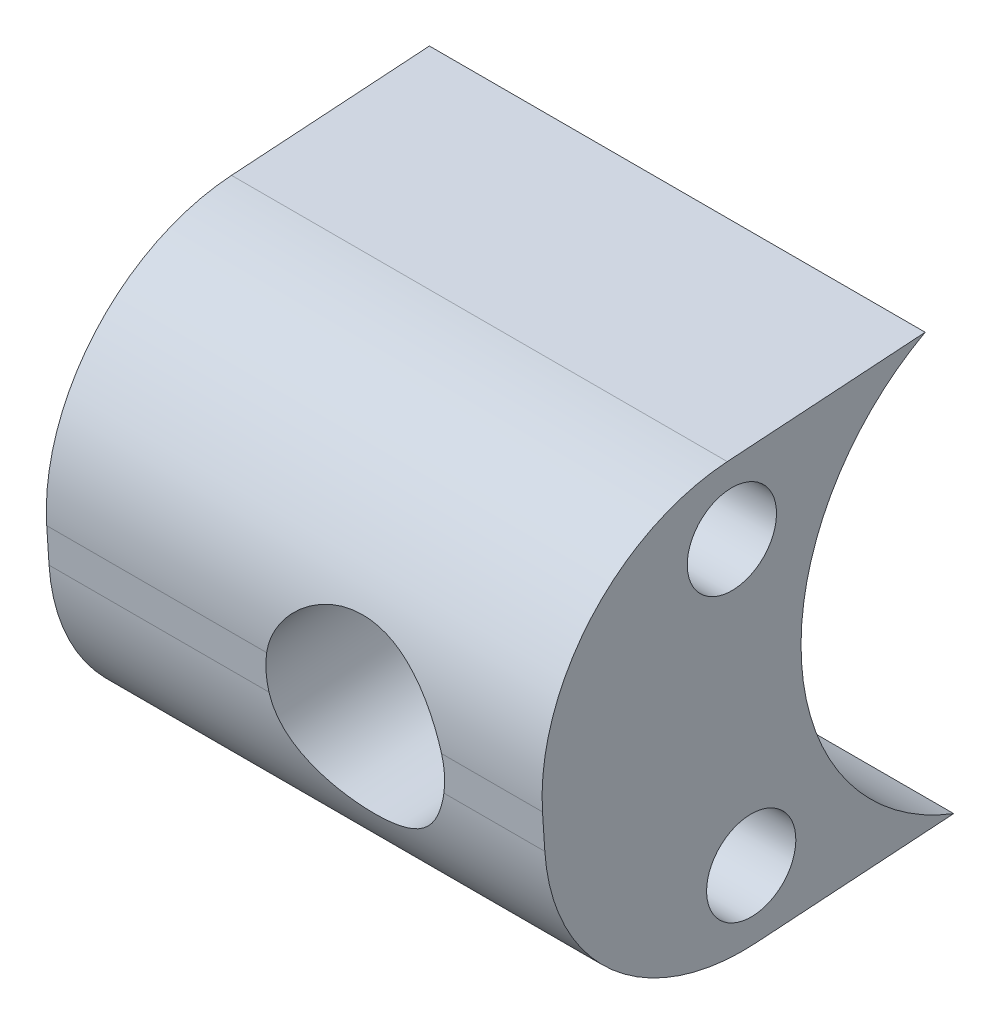
from build123d import *

# Parameters (mm, degrees)
BOSS_EXTRUDE1_DEPTH     = 25
CUT_EXTRUDE1_DEPTH      = 118.647905993
CUT_EXTRUDE1_DEPTH_BACK = 118.647905993
SKETCH2_R               = 4.5
SKETCH4_R               = 1
CUT_EXTRUDE3_DEPTH      = 114.903893928
SKETCH5_R               = 2.25
CUT_EXTRUDE4_DEPTH      = 13


with BuildPart() as part:
    # Sketch1 → Boss-Extrude1 (new body)
    with BuildSketch(Plane(origin=(-10, 0, 0), x_dir=(0, 0, -1), z_dir=(1, 0, 0))):
        with BuildLine():
            Line((-95.101282582, 44.173788963), (-95.219276466, 45.957628532))
            ThreePointArc((-95.219276466, 45.957628532), (-92.763433913, 53.206592673), (-85.901099289, 56.595841451))
            Line((-85.901099289, 56.595841451), (-75.922904242, 57.255859321))
            ThreePointArc((-75.922904242, 57.255859321), (-82.156438236, 45.925861069), (-74.484874616, 35.515629656))
            Line((-74.484874616, 35.515629656), (-84.463069663, 34.855611786))
            ThreePointArc((-84.463069663, 34.855611786), (-91.712033804, 37.311454339), (-95.101282582, 44.173788963))
        make_face()
    extrude(amount=BOSS_EXTRUDE1_DEPTH)

    # Sketch2 → Cut-Extrude1 (cut, two sides: drawn at the far end of the back side and taken through both)
    with BuildSketch(Plane(origin=(0, 0.216574413, -6.555528357), x_dir=(1, 0, 0), z_dir=(0, -0.06600178707669223, 0.9978195047716211)).offset(-CUT_EXTRUDE1_DEPTH_BACK)):
        with Locations(Location((5.5, 51.464766105, 0), (0, 0, 90))):
            Circle(SKETCH2_R)
    extrude(amount=CUT_EXTRUDE1_DEPTH + CUT_EXTRUDE1_DEPTH_BACK, mode=Mode.SUBTRACT)

    # Sketch4 → Cut-Extrude3 (cut, through all)
    with BuildSketch(Plane.ZY.offset(10)):
        with Locations(Location((85.669468509, 53.094031558, 0), (0, 0, 270))):
            Circle(SKETCH4_R)
        with Locations(Location((84.694700444, 38.357421678, 0), (0, 0, 270))):
            Circle(SKETCH4_R)
    extrude(amount=-CUT_EXTRUDE3_DEPTH, mode=Mode.SUBTRACT)

    # Sketch5 → Cut-Extrude4 (cut)
    with BuildSketch(Plane(origin=(15, 0, 0), x_dir=(0, 0, -1), z_dir=(1, 0, 0))):
        with Locations(Location((-84.694700444, 38.357421678, 0), (0, 0, 90))):
            Circle(SKETCH5_R)
        with Locations(Location((-85.669468509, 53.094031558, 0), (0, 0, 90))):
            Circle(SKETCH5_R)
    extrude(amount=-CUT_EXTRUDE4_DEPTH, mode=Mode.SUBTRACT)


solid = part.part
